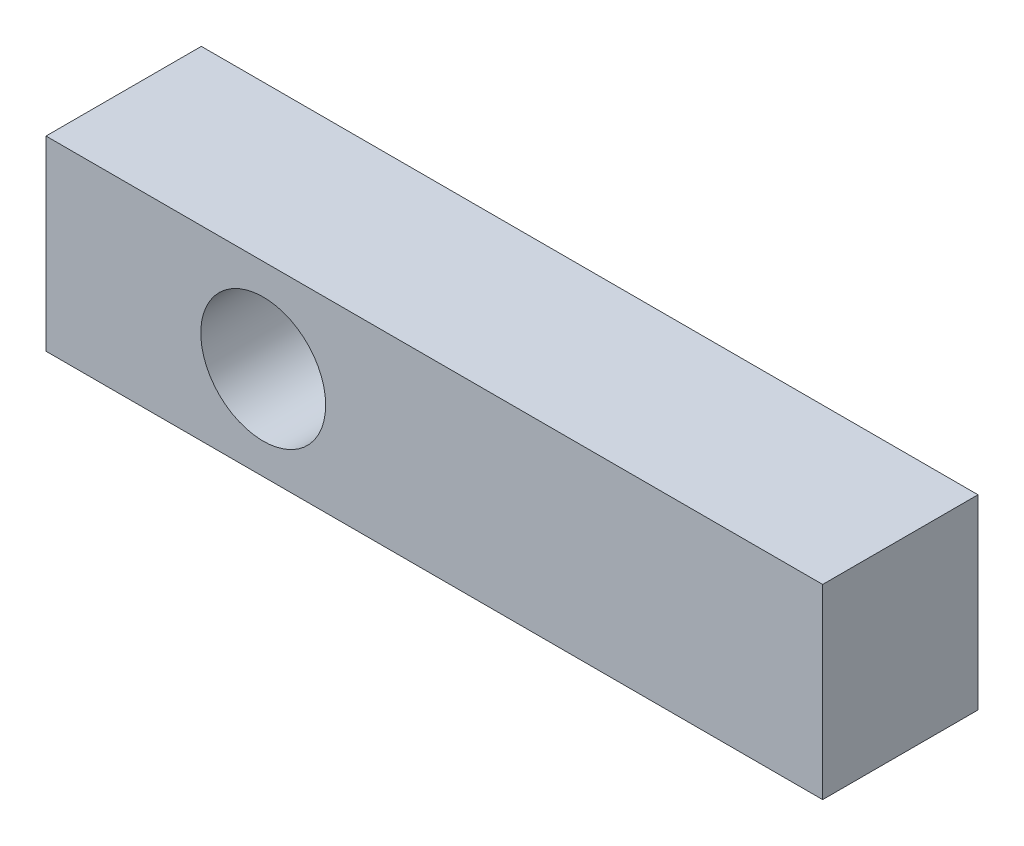
from build123d import *

# Parameters (mm, degrees)
SKETCH1_W           = 25
SKETCH1_H           = 6
BOSS_EXTRUDE1_DEPTH = 5
SKETCH2_R           = 2.01
CUT_EXTRUDE1_DEPTH  = 5


with BuildPart() as part:
    # Sketch1 → Boss-Extrude1 (new body)
    with BuildSketch(Plane.XY):
        Rectangle(SKETCH1_W, SKETCH1_H)
    extrude(amount=BOSS_EXTRUDE1_DEPTH)

    # Sketch2 → Cut-Extrude1 (cut)
    with BuildSketch(Plane.XY.offset(5)):
        with Locations((-5.507795847, 0)):
            Circle(SKETCH2_R)
    extrude(amount=-CUT_EXTRUDE1_DEPTH, mode=Mode.SUBTRACT)


solid = part.part
